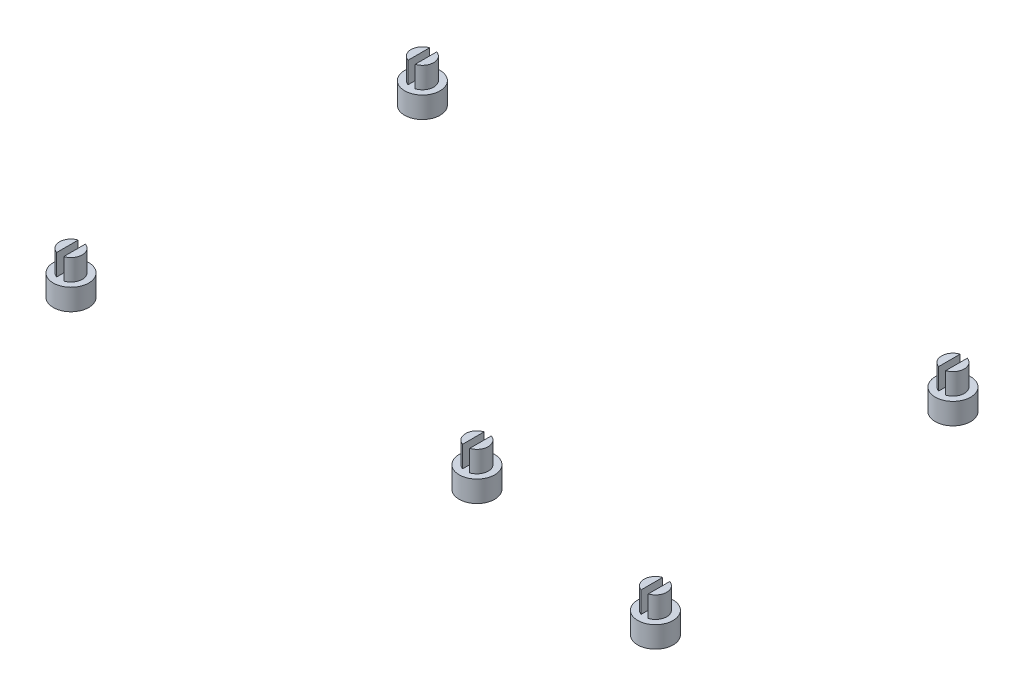
from build123d import *

# Parameters (mm, degrees)
SKETCH3_R             = 2.5
BOSS_EXTRUDE2_DEPTH   = 3
BOSS_EXTRUDE2_2_DEPTH = 3
BOSS_EXTRUDE2_3_DEPTH = 3
BOSS_EXTRUDE2_4_DEPTH = 3
BOSS_EXTRUDE2_5_DEPTH = 3
BOSS_EXTRUDE1_START   = 3
BOSS_EXTRUDE1_DEPTH   = 3


with BuildPart() as part:
    # Sketch3 → Boss-Extrude2 (new body)
    with BuildSketch(Plane(origin=(0, 25.029873021, 0), x_dir=(1, 0, 0), z_dir=(0, 1, 0))):
        with Locations(Location((-17.62934747, -15.391511653, 0), (0, 0, 270))):
            Circle(SKETCH3_R)
    extrude(amount=BOSS_EXTRUDE2_DEPTH)



with BuildPart() as body_2:
    # Sketch3 → Boss-Extrude2 2 (new body)
    with BuildSketch(Plane(origin=(0, 25.029873021, 0), x_dir=(1, 0, 0), z_dir=(0, 1, 0))):
        with Locations(Location((57.27065253, -15.391511653, 0), (0, 0, 270))):
            Circle(SKETCH3_R)
    extrude(amount=BOSS_EXTRUDE2_2_DEPTH)


with BuildPart() as body_3:
    # Sketch3 → Boss-Extrude2 3 (new body)
    with BuildSketch(Plane(origin=(0, 25.029873021, 0), x_dir=(1, 0, 0), z_dir=(0, 1, 0))):
        with Locations(Location((63.57065253, -63.691511653, 0), (0, 0, 270))):
            Circle(SKETCH3_R)
    extrude(amount=BOSS_EXTRUDE2_3_DEPTH)


with BuildPart() as body_4:
    # Sketch3 → Boss-Extrude2 4 (new body)
    with BuildSketch(Plane(origin=(0, 25.029873021, 0), x_dir=(1, 0, 0), z_dir=(0, 1, 0))):
        with Locations(Location((33.17065253, -58.491511653, 0), (0, 0, 270))):
            Circle(SKETCH3_R)
    extrude(amount=BOSS_EXTRUDE2_4_DEPTH)


with BuildPart() as body_5:
    # Sketch3 → Boss-Extrude2 5 (new body)
    with BuildSketch(Plane(origin=(0, 25.029873021, 0), x_dir=(1, 0, 0), z_dir=(0, 1, 0))):
        with Locations(Location((-18.92934747, -63.691511653, 0), (0, 0, 270))):
            Circle(SKETCH3_R)
    extrude(amount=BOSS_EXTRUDE2_5_DEPTH)


with BuildPart() as part_1:
    add(part.part)

    add(body_2.part)  # Boss-Extrude1 merges body 2

    add(body_3.part)  # Boss-Extrude1 merges body 3

    add(body_4.part)  # Boss-Extrude1 merges body 4

    add(body_5.part)  # Boss-Extrude1 merges body 5
    # Sketch1 → Boss-Extrude1 (add)
    with BuildSketch(Plane(origin=(0, 25.029873021, 0), x_dir=(1, 0, 0), z_dir=(0, 1, 0)).offset(BOSS_EXTRUDE1_START)):
        with BuildLine():
            Line((-17.12934747, -13.871643238), (-17.12934747, -16.911380069))
            ThreePointArc((-17.12934747, -16.911380069), (-16.33319933, -16.329594805), (-16.02934747, -15.391511653))
            ThreePointArc((-16.02934747, -15.391511653), (-16.33319933, -14.453428501), (-17.12934747, -13.871643238))
        make_face()
        with BuildLine():
            ThreePointArc((-18.12934747, -13.871643238), (-19.22934747, -15.391511653), (-18.12934747, -16.911380069))
            Line((-18.12934747, -16.911380069), (-18.12934747, -13.871643238))
        make_face()
        with BuildLine():
            ThreePointArc((65.17065253, -63.691511653), (64.86680067, -62.753428501), (64.07065253, -62.171643238))
            Line((64.07065253, -62.171643238), (64.07065253, -65.211380069))
            ThreePointArc((64.07065253, -65.211380069), (64.86680067, -64.629594805), (65.17065253, -63.691511653))
        make_face()
        with BuildLine():
            Line((63.07065253, -65.211380069), (63.07065253, -62.171643238))
            ThreePointArc((63.07065253, -62.171643238), (61.97065253, -63.691511653), (63.07065253, -65.211380069))
        make_face()
        with BuildLine():
            ThreePointArc((34.77065253, -58.491511653), (34.46680067, -57.553428501), (33.67065253, -56.971643238))
            Line((33.67065253, -56.971643238), (33.67065253, -60.011380069))
            ThreePointArc((33.67065253, -60.011380069), (34.46680067, -59.429594805), (34.77065253, -58.491511653))
        make_face()
        with BuildLine():
            Line((32.67065253, -60.011380069), (32.67065253, -56.971643238))
            ThreePointArc((32.67065253, -56.971643238), (31.57065253, -58.491511653), (32.67065253, -60.011380069))
        make_face()
        with BuildLine():
            ThreePointArc((-17.32934747, -63.691511653), (-17.63319933, -62.753428501), (-18.42934747, -62.171643238))
            Line((-18.42934747, -62.171643238), (-18.42934747, -65.211380069))
            ThreePointArc((-18.42934747, -65.211380069), (-17.63319933, -64.629594805), (-17.32934747, -63.691511653))
        make_face()
        with BuildLine():
            Line((-19.42934747, -65.211380069), (-19.42934747, -62.171643238))
            ThreePointArc((-19.42934747, -62.171643238), (-20.52934747, -63.691511653), (-19.42934747, -65.211380069))
        make_face()
        with BuildLine():
            ThreePointArc((58.87065253, -15.391511653), (58.56680067, -14.453428501), (57.77065253, -13.871643238))
            Line((57.77065253, -13.871643238), (57.77065253, -16.911380069))
            ThreePointArc((57.77065253, -16.911380069), (58.56680067, -16.329594805), (58.87065253, -15.391511653))
        make_face()
        with BuildLine():
            Line((56.77065253, -16.911380069), (56.77065253, -13.871643238))
            ThreePointArc((56.77065253, -13.871643238), (55.67065253, -15.391511653), (56.77065253, -16.911380069))
        make_face()
    extrude(amount=BOSS_EXTRUDE1_DEPTH)


solid = part_1.part
